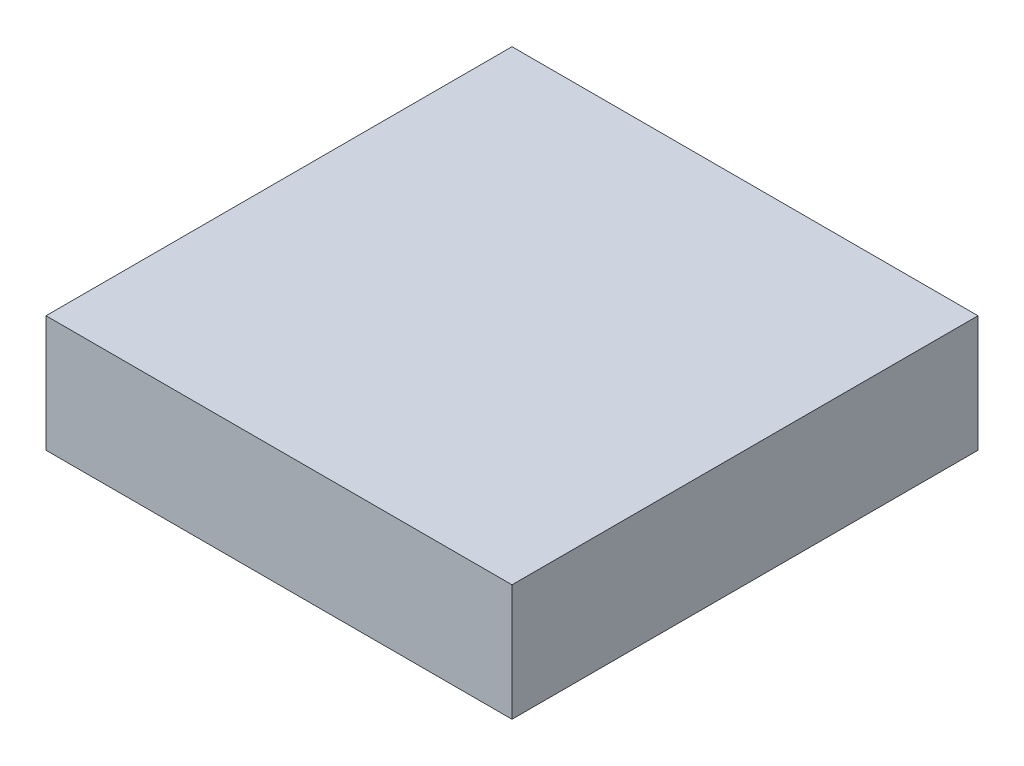
from build123d import *

# Parameters (mm, degrees)
SKETCH1_W           = 200
SKETCH1_H           = 200
BOSS_EXTRUDE1_DEPTH = 50


with BuildPart() as part:
    # Sketch1 → Boss-Extrude1 (new body)
    with BuildSketch(Plane(origin=(0, 0, 0), x_dir=(1, 0, 0), z_dir=(0, 1, 0))):
        Rectangle(SKETCH1_W, SKETCH1_H)
    extrude(amount=BOSS_EXTRUDE1_DEPTH)


solid = part.part
